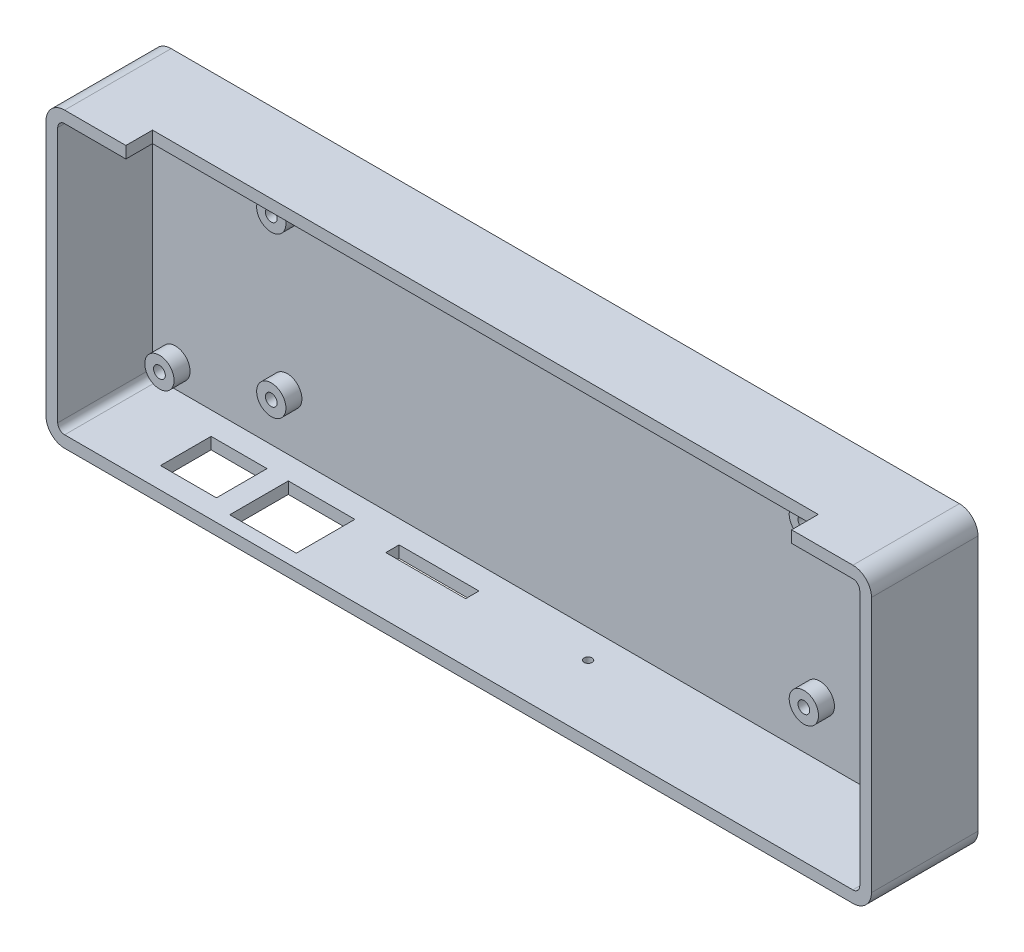
from build123d import *

# Parameters (mm, degrees)
SKETCH_1_W          = 155
SKETCH_1_H          = 55
EXTRUDE_1_DEPTH     = 20
FILLET_1_R          = 3.5
SHELL_1_T           = -2.2
SKETCH_2_R          = 1.1
CUT_EXTRUDE_1_DEPTH = 10
EXTRUDE_START       = 3
SKETCH_3_R          = 2.75
SKETCH_3_R_2        = 1.1
EXTRUDE_2_DEPTH     = 3
SKETCH_4_R          = 0.75
SKETCH_4_W          = 10.5
SKETCH_4_H          = 9.5
SKETCH_4_W_2        = 12.5
SKETCH_4_H_2        = 11
SKETCH_4_W_3        = 15
SKETCH_4_H_3        = 2.5
CUT_EXTRUDE_2_DEPTH = 3
SKETCH_5_W          = 125
SKETCH_5_H          = 5
CUT_EXTRUDE_3_DEPTH = 3


with BuildPart() as part:
    # 草图1 → 凸台-拉伸1 (new body)
    with BuildSketch(Plane.XY):
        with Locations((77.5, -27.5)):
            Rectangle(SKETCH_1_W, SKETCH_1_H)
    extrude(amount=EXTRUDE_1_DEPTH)

    # 圆角1
    fillet_1_edges = [part.edges().sort_by_distance(p)[0] for p in [
        (0, 0, 10),
        (155, 0, 10),
        (155, -55, 10),
        (0, -55, 10),
    ]]
    fillet(fillet_1_edges, radius=FILLET_1_R)

    # 抽壳1
    shell_1_openings = [part.faces().sort_by_distance(p)[0] for p in [
        (77.5, -27.5, 20),
    ]]
    offset(amount=SHELL_1_T, openings=shell_1_openings, kind=Kind.INTERSECTION)

    # 草图2 → 切除-拉伸1 (cut)
    with BuildSketch(Plane.XY.offset(2.2)):
        with Locations((27.5, -12.5)):
            Circle(SKETCH_2_R)
        with Locations((127.5, -12.5)):
            Circle(SKETCH_2_R)
        with Locations((127.5, -42.5)):
            Circle(SKETCH_2_R)
        with Locations((27.5, -42.5)):
            Circle(SKETCH_2_R)
    extrude(amount=-CUT_EXTRUDE_1_DEPTH, mode=Mode.SUBTRACT)

    # 草图3 → 凸台-拉伸2 (add)
    # profile 1 of 8: a face of its own
    with BuildSketch(Plane.XY.offset(2.2).offset(EXTRUDE_START)):
        with Locations((27.5, -12.5)):
            Circle(SKETCH_3_R)
        with Locations((27.5, -12.5)):
            Circle(SKETCH_3_R_2, mode=Mode.SUBTRACT)
    # profile 2 of 8: a face of its own
    with BuildSketch(Plane.XY.offset(2.2).offset(EXTRUDE_START)):
        with Locations((127.5, -12.5)):
            Circle(SKETCH_3_R)
        with Locations((127.5, -12.5)):
            Circle(SKETCH_3_R_2, mode=Mode.SUBTRACT)
    # profile 3 of 8: a face of its own
    with BuildSketch(Plane.XY.offset(2.2).offset(EXTRUDE_START)):
        with Locations((127.5, -42.5)):
            Circle(SKETCH_3_R)
        with Locations((127.5, -42.5)):
            Circle(SKETCH_3_R_2, mode=Mode.SUBTRACT)
    # profile 4 of 8: a face of its own
    with BuildSketch(Plane.XY.offset(2.2).offset(EXTRUDE_START)):
        with Locations((27.5, -42.5)):
            Circle(SKETCH_3_R)
        with Locations((27.5, -42.5)):
            Circle(SKETCH_3_R_2, mode=Mode.SUBTRACT)
    # profile 5 of 8: a face of its own
    with BuildSketch(Plane.XY.offset(2.2).offset(EXTRUDE_START)):
        with Locations((6.5, -6.5)):
            Circle(SKETCH_3_R)
        with Locations((6.5, -6.5)):
            Circle(SKETCH_3_R_2, mode=Mode.SUBTRACT)
    # profile 6 of 8: a face of its own
    with BuildSketch(Plane.XY.offset(2.2).offset(EXTRUDE_START)):
        with Locations((148.5, -6.5)):
            Circle(SKETCH_3_R)
        with Locations((148.5, -6.5)):
            Circle(SKETCH_3_R_2, mode=Mode.SUBTRACT)
    # profile 7 of 8: a face of its own
    with BuildSketch(Plane.XY.offset(2.2).offset(EXTRUDE_START)):
        with Locations((148.5, -48.5)):
            Circle(SKETCH_3_R)
        with Locations((148.5, -48.5)):
            Circle(SKETCH_3_R_2, mode=Mode.SUBTRACT)
    # profile 8 of 8: a face of its own
    with BuildSketch(Plane.XY.offset(2.2).offset(EXTRUDE_START)):
        with Locations((6.5, -48.5)):
            Circle(SKETCH_3_R)
        with Locations((6.5, -48.5)):
            Circle(SKETCH_3_R_2, mode=Mode.SUBTRACT)
    extrude(amount=-EXTRUDE_2_DEPTH)

    # 草图4 → 切除-拉伸2 (cut)
    with BuildSketch(Plane.XZ.offset(55)):
        with Locations(Location((89.3, 7.5, 0), (0, 0, 270))):
            Circle(SKETCH_4_R)
        with Locations((22.75, 11.25)):
            Rectangle(SKETCH_4_W, SKETCH_4_H)
        with Locations((38.25, 12)):
            Rectangle(SKETCH_4_W_2, SKETCH_4_H_2)
        with Locations((60.3, 7.75)):
            Rectangle(SKETCH_4_W_3, SKETCH_4_H_3)
    extrude(amount=-CUT_EXTRUDE_2_DEPTH, mode=Mode.SUBTRACT)

    # 草图5 → 切除-拉伸3 (cut)
    with BuildSketch(Plane(origin=(0, 0, 0), x_dir=(1, 0, 0), z_dir=(0, 1, 0))):
        with Locations((77.5, -17.5)):
            Rectangle(SKETCH_5_W, SKETCH_5_H)
    extrude(amount=-CUT_EXTRUDE_3_DEPTH, mode=Mode.SUBTRACT)


solid = part.part
